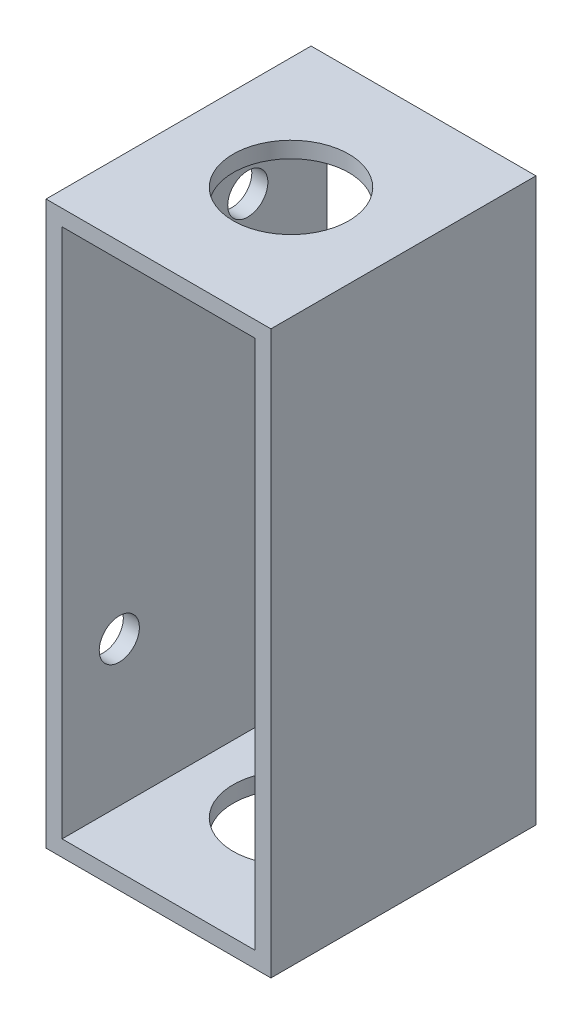
from build123d import *

# Parameters (mm, degrees)
SKETCH1_W               = 14
SKETCH1_H               = 35
BOSS_EXTRUDE1_DEPTH     = 16.5
CUT_EXTRUDE3_DEPTH      = 37.989863476
CUT_EXTRUDE3_DEPTH_BACK = 37.989863476
SKETCH3_OUTSIDE_W       = 24.23
SKETCH3_OUTSIDE_H       = 45.23
SKETCH3_OUTSIDE_W_2     = 14
SKETCH3_OUTSIDE_H_2     = 35
SKETCH3_OUTSIDE_W_3     = 12
SKETCH3_OUTSIDE_H_3     = 33
CUT_EXTRUDE4_DEPTH      = 37.989863476
CUT_EXTRUDE4_DEPTH_BACK = 40.5
SKETCH4_R               = 3.6
SKETCH5_R               = 1.25
CUT_EXTRUDE6_DEPTH      = 1


with BuildPart() as part:
    # Sketch1 → Boss-Extrude1 (new body)
    with BuildSketch(Plane.XY):
        with Locations((7, 12.5)):
            Rectangle(SKETCH1_W, SKETCH1_H)
    extrude(amount=BOSS_EXTRUDE1_DEPTH)

    # Sketch3 outside → Cut-Extrude3 (cut, two sides: drawn at the far end of the back side and taken through both)
    # profile 1 of 2: a face of its own
    with BuildSketch(Plane.XY.offset(-CUT_EXTRUDE3_DEPTH_BACK)):
        with Locations((7, 12.5)):
            Rectangle(SKETCH3_OUTSIDE_W, SKETCH3_OUTSIDE_H)
        with Locations((7, 12.5)):
            Rectangle(SKETCH3_OUTSIDE_W_2, SKETCH3_OUTSIDE_H_2, mode=Mode.SUBTRACT)
    # profile 2 of 2: a face of its own
    with BuildSketch(Plane.XY.offset(-CUT_EXTRUDE3_DEPTH_BACK)):
        with Locations((7, 12.5)):
            Rectangle(SKETCH3_OUTSIDE_W_3, SKETCH3_OUTSIDE_H_3)
    extrude(amount=CUT_EXTRUDE3_DEPTH + CUT_EXTRUDE3_DEPTH_BACK, mode=Mode.SUBTRACT)

    # Sketch4 → Cut-Extrude4 (cut, two sides: drawn at the far end of the back side and taken through both)
    with BuildSketch(Plane(origin=(0, 0, 0), x_dir=(1, 0, 0), z_dir=(0, 1, 0)).offset(-CUT_EXTRUDE4_DEPTH_BACK)):
        with Locations((7, -8.25)):
            Circle(SKETCH4_R)
    extrude(amount=CUT_EXTRUDE4_DEPTH + CUT_EXTRUDE4_DEPTH_BACK, mode=Mode.SUBTRACT)

    # Sketch5 → Cut-Extrude6 (cut)
    with BuildSketch(Plane(origin=(0, 0, 0), x_dir=(0, 0, -1), z_dir=(1, 0, 0))):
        with Locations(Location((-4.939666778, 25, 0), (0, 0, 270))):
            Circle(SKETCH5_R)
        with Locations(Location((-12.939666778, 5, 0), (0, 0, 270))):
            Circle(SKETCH5_R)
    extrude(amount=CUT_EXTRUDE6_DEPTH, mode=Mode.SUBTRACT)


solid = part.part
